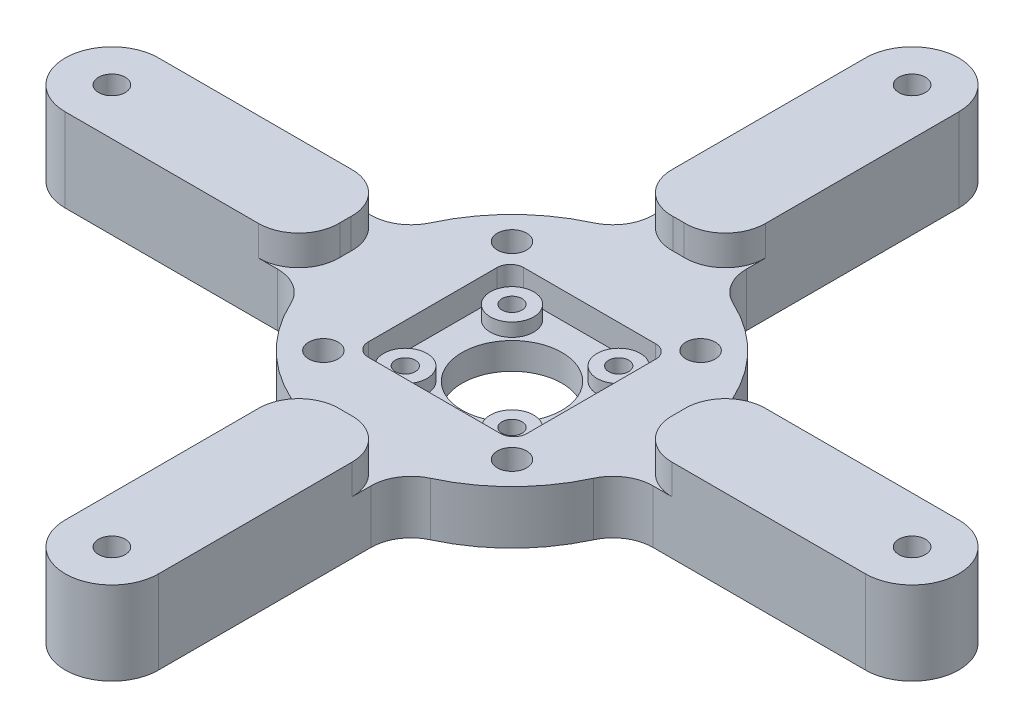
from build123d import *

# Parameters (mm, degrees)
ESQUISSE1_R             = 2.2
ESQUISSE1_R_2           = 1.5
ESQUISSE1_R_3           = 2
BOSS_EXTRU_1_DEPTH      = 8
ESQUISSE2_W             = 23.8
ESQUISSE2_H             = 23.3
ENL_V_MAT_EXTRU_1_DEPTH = 2
CONG_1_R                = 2
ENL_V_START             = -2
ESQUISSE4_R             = 3.25
ENL_V_MAT_EXTRU_2_DEPTH = 2
ESQUISSE5_R             = 7.5
ENL_V_MAT_EXTRU_3_DEPTH = 95.836701756
ESQUISSE6_R             = 2
BOSS_EXTRU_2_DEPTH      = 4.5
CONG_2_R                = 6
CONG_3_R                = 6


with BuildPart() as part:
    # Esquisse1 → Boss.-Extru.1 (new body)
    with BuildSketch(Plane(origin=(0, 0, 0), x_dir=(1, 0, 0), z_dir=(0, 1, 0))):
        with BuildLine():
            Line((60, 7), (24, 7))
            ThreePointArc((24, 7), (17.67766953, 17.67766953), (7, 24))
            Line((7, 24), (7, 60))
            ThreePointArc((7, 60), (0, 67), (-7, 60))
            Line((-7, 60), (-7, 24))
            ThreePointArc((-7, 24), (-17.67766953, 17.67766953), (-24, 7))
            Line((-24, 7), (-60, 7))
            ThreePointArc((-60, 7), (-67, 0), (-60, -7))
            Line((-60, -7), (-24, -7))
            ThreePointArc((-24, -7), (-17.67766953, -17.67766953), (-7, -24))
            Line((-7, -24), (-7, -60))
            ThreePointArc((-7, -60), (0, -67), (7, -60))
            Line((7, -60), (7, -24))
            ThreePointArc((7, -24), (17.67766953, -17.67766953), (24, -7))
            Line((24, -7), (60, -7))
            ThreePointArc((60, -7), (67, 0), (60, 7))
        make_face()
        with Locations(Location((14.142135624, 14.142135624, 0), (0, 0, 270))):
            Circle(ESQUISSE1_R, mode=Mode.SUBTRACT)
        with Locations(Location((14.142135624, -14.142135624, 0), (0, 0, 270))):
            Circle(ESQUISSE1_R, mode=Mode.SUBTRACT)
        with Locations(Location((-14.142135624, -14.142135624, 0), (0, 0, 270))):
            Circle(ESQUISSE1_R, mode=Mode.SUBTRACT)
        with Locations(Location((-14.142135624, 14.142135624, 0), (0, 0, 270))):
            Circle(ESQUISSE1_R, mode=Mode.SUBTRACT)
        with Locations(Location((-8, 8, 0), (0, 0, 270))):
            Circle(ESQUISSE1_R_2, mode=Mode.SUBTRACT)
        with Locations(Location((-8, -8, 0), (0, 0, 270))):
            Circle(ESQUISSE1_R_2, mode=Mode.SUBTRACT)
        with Locations(Location((8, -8, 0), (0, 0, 270))):
            Circle(ESQUISSE1_R_2, mode=Mode.SUBTRACT)
        with Locations(Location((8, 8, 0), (0, 0, 270))):
            Circle(ESQUISSE1_R_2, mode=Mode.SUBTRACT)
        with Locations(Location((60, 0, 0), (0, 0, 270))):
            Circle(ESQUISSE1_R_3, mode=Mode.SUBTRACT)
        with Locations(Location((0, -60, 0), (0, 0, 270))):
            Circle(ESQUISSE1_R_3, mode=Mode.SUBTRACT)
        with Locations(Location((-60, 0, 0), (0, 0, 270))):
            Circle(ESQUISSE1_R_3, mode=Mode.SUBTRACT)
        with Locations(Location((0, 60, 0), (0, 0, 270))):
            Circle(ESQUISSE1_R_3, mode=Mode.SUBTRACT)
    extrude(amount=BOSS_EXTRU_1_DEPTH)

    # Esquisse2 → Enlèv. mat.-Extru.1 (cut)
    with BuildSketch(Plane(origin=(0, 8, 0), x_dir=(1, 0, 0), z_dir=(0, 1, 0))):
        Rectangle(ESQUISSE2_W, ESQUISSE2_H)
    extrude(amount=-ENL_V_MAT_EXTRU_1_DEPTH, mode=Mode.SUBTRACT)

    # Congé1
    cong_1_edges = [part.edges().sort_by_distance(p)[0] for p in [
        (-11.9, 7, 11.65),
        (-11.9, 7, -11.65),
        (11.9, 7, -11.65),
        (11.9, 7, 11.65),
    ]]
    fillet(cong_1_edges, radius=CONG_1_R)

    # Esquisse4 → Enlèv. mat.-Extru.2 (cut)
    with BuildSketch(Plane(origin=(0, 6, 0), x_dir=(1, 0, 0), z_dir=(0, 1, 0)).offset(ENL_V_START)):
        with BuildLine():
            Line((-11.9, 9.65), (-11.9, -9.65))
            ThreePointArc((-11.9, -9.65), (-11.314213562, -11.064213562), (-9.9, -11.65))
            Line((-9.9, -11.65), (9.9, -11.65))
            ThreePointArc((9.9, -11.65), (11.314213562, -11.064213562), (11.9, -9.65))
            Line((11.9, -9.65), (11.9, 9.65))
            ThreePointArc((11.9, 9.65), (11.314213562, 11.064213562), (9.9, 11.65))
            Line((9.9, 11.65), (-9.9, 11.65))
            ThreePointArc((-9.9, 11.65), (-11.314213562, 11.064213562), (-11.9, 9.65))
        make_face()
        with Locations(Location((8, 8, 0), (0, 0, 270))):
            Circle(ESQUISSE4_R, mode=Mode.SUBTRACT)
        with Locations(Location((-8, 8, 0), (0, 0, 270))):
            Circle(ESQUISSE4_R, mode=Mode.SUBTRACT)
        with Locations(Location((-8, -8, 0), (0, 0, 270))):
            Circle(ESQUISSE4_R, mode=Mode.SUBTRACT)
        with Locations(Location((8, -8, 0), (0, 0, 270))):
            Circle(ESQUISSE4_R, mode=Mode.SUBTRACT)
    extrude(amount=ENL_V_MAT_EXTRU_2_DEPTH, mode=Mode.SUBTRACT)

    # Esquisse5 → Enlèv. mat.-Extru.3 (cut, through all)
    with BuildSketch(Plane(origin=(0, 4, 0), x_dir=(1, 0, 0), z_dir=(0, 1, 0))):
        with Locations(Location((0, 0, 0), (0, 0, 270))):
            Circle(ESQUISSE5_R)
    extrude(amount=-ENL_V_MAT_EXTRU_3_DEPTH, mode=Mode.SUBTRACT)

    # Esquisse6 → Boss.-Extru.2 (add)
    # profile 1 of 4: a face of its own
    with BuildSketch(Plane(origin=(0, 8, 0), x_dir=(1, 0, 0), z_dir=(0, 1, 0))):
        with BuildLine():
            Line((24, -7), (60, -7))
            ThreePointArc((60, -7), (67, 0), (60, 7))
            Line((60, 7), (24, 7))
            ThreePointArc((24, 7), (25, 0), (24, -7))
        make_face()
        with Locations(Location((60, 0, 0), (0, 0, 270))):
            Circle(ESQUISSE6_R, mode=Mode.SUBTRACT)
    # profile 2 of 4: a face of its own
    with BuildSketch(Plane(origin=(0, 8, 0), x_dir=(1, 0, 0), z_dir=(0, 1, 0))):
        with BuildLine():
            Line((7, 24), (7, 60))
            ThreePointArc((7, 60), (0, 67), (-7, 60))
            Line((-7, 60), (-7, 24))
            ThreePointArc((-7, 24), (0, 25), (7, 24))
        make_face()
        with Locations(Location((0, 60, 0), (0, 0, 270))):
            Circle(ESQUISSE6_R, mode=Mode.SUBTRACT)
    # profile 3 of 4: a face of its own
    with BuildSketch(Plane(origin=(0, 8, 0), x_dir=(1, 0, 0), z_dir=(0, 1, 0))):
        with BuildLine():
            Line((-24, 7), (-60, 7))
            ThreePointArc((-60, 7), (-67, 0), (-60, -7))
            Line((-60, -7), (-24, -7))
            ThreePointArc((-24, -7), (-25, 0), (-24, 7))
        make_face()
        with Locations(Location((-60, 0, 0), (0, 0, 270))):
            Circle(ESQUISSE6_R, mode=Mode.SUBTRACT)
    # profile 4 of 4: a face of its own
    with BuildSketch(Plane(origin=(0, 8, 0), x_dir=(1, 0, 0), z_dir=(0, 1, 0))):
        with BuildLine():
            Line((-7, -24), (-7, -60))
            ThreePointArc((-7, -60), (0, -67), (7, -60))
            Line((7, -60), (7, -24))
            ThreePointArc((7, -24), (0, -25), (-7, -24))
        make_face()
        with Locations(Location((0, -60, 0), (0, 0, 270))):
            Circle(ESQUISSE6_R, mode=Mode.SUBTRACT)
    extrude(amount=BOSS_EXTRU_2_DEPTH)

    # Congé2
    cong_2_edges = [part.edges().sort_by_distance(p)[0] for p in [
        (7, 10.25, 24),
        (-7, 10.25, 24),
        (24, 10.25, -7),
        (24, 10.25, 7),
        (-7, 10.25, -24),
        (7, 10.25, -24),
        (-24, 10.25, 7),
        (-24, 10.25, -7),
    ]]
    fillet(cong_2_edges, radius=CONG_2_R)

    # Congé3
    cong_3_edges = [part.edges().sort_by_distance(p)[0] for p in [
        (7, 4, 24),
        (-7, 4, 24),
        (-24, 4, 7),
        (-24, 4, -7),
        (-7, 4, -24),
        (7, 4, -24),
        (24, 4, -7),
        (24, 4, 7),
    ]]
    fillet(cong_3_edges, radius=CONG_3_R)


solid = part.part
